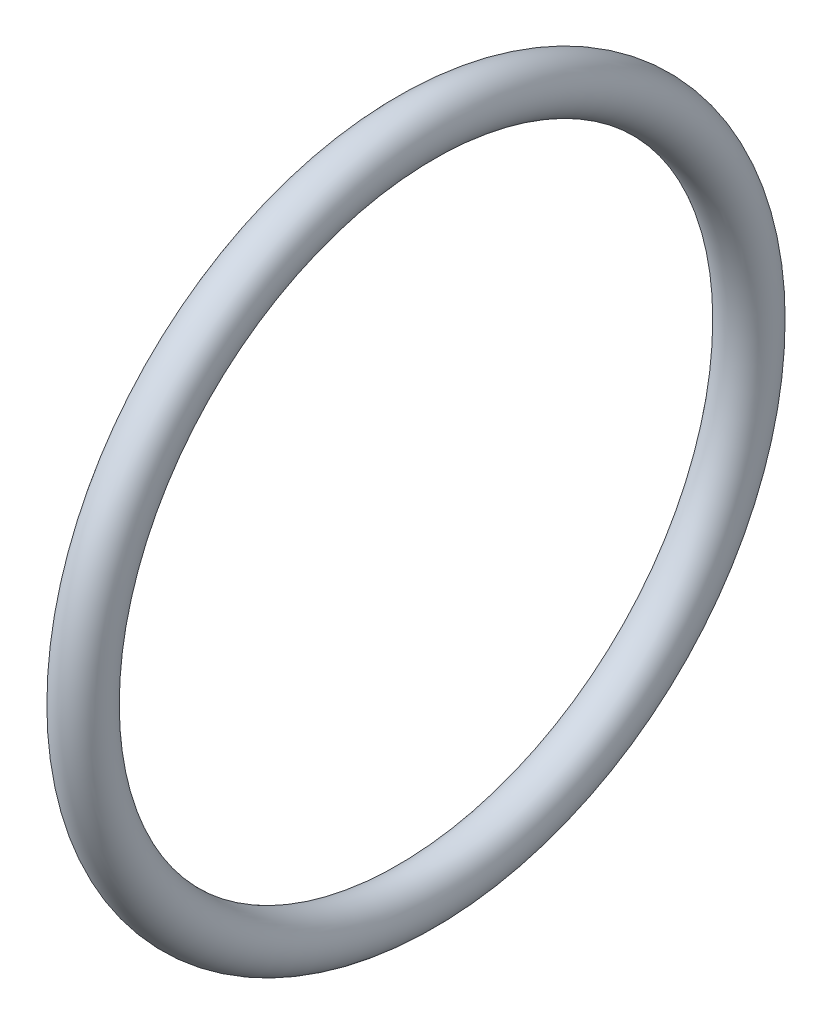
from build123d import *

# Parameters (mm, degrees)
SKETCH1_R = 6.35


with BuildPart() as part:
    # Sketch1 → Revolve1 (revolve)
    with BuildSketch(Plane.XY, mode=Mode.PRIVATE) as revolve1_sk:
        with Locations((0, 82.55)):
            Circle(SKETCH1_R)
    revolve(revolve1_sk.sketch.rotate(Axis((0, 0, 0), (1, 0, 0)), 90), axis=Axis((0, 0, 0), (1, 0, 0)))


solid = part.part
